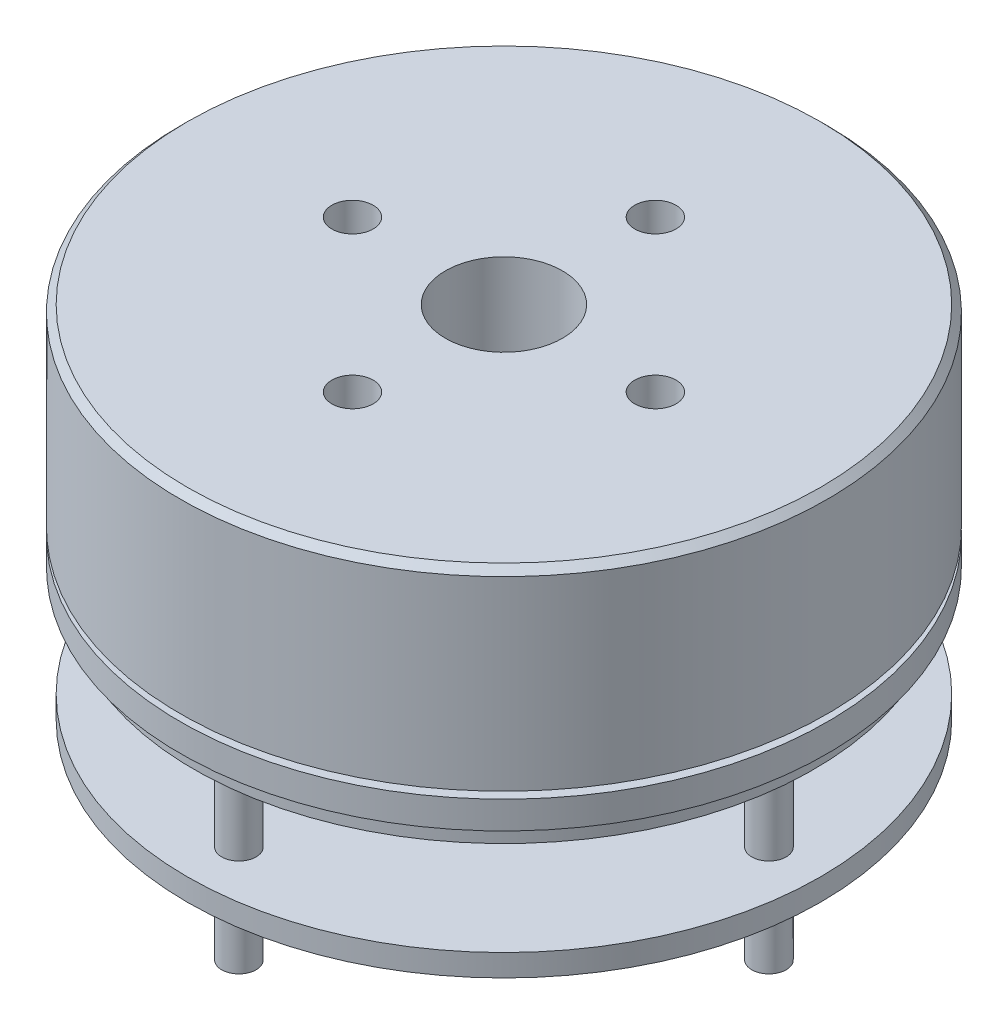
from build123d import *

# Parameters (mm, degrees)
SKETCH_2_R          = 1.5
CUT_EXTRUDE_1_DEPTH = 3
SKETCH_3_R          = 4.25
CUT_EXTRUDE_2_DEPTH = 18
SKETCH_6_R          = 1.25
EXTRUDE_1_DEPTH     = 6.5
SKETCH_7_R          = 23
EXTRUDE_2_DEPTH     = 1.6
SKETCH_10_R         = 1.25
EXTRUDE_3_DEPTH     = 5.5


with BuildPart() as part:
    # 草图1 → 旋转1 (revolve)
    with BuildSketch(Plane.XY, mode=Mode.PRIVATE) as revolve_1_sk:
        Polygon((23, 22.1), (0, 22.1), (0, 0), (4.75, 0), (7.5, 4.1), (22.5, 4.1), (22.5, 5.6), (23.5, 5.6), (23.5, 7.6), (22.5, 7.6), (22.5, 8.1), (23.5, 8.1), (23.5, 21.6), align=None)
    revolve(revolve_1_sk.sketch.rotate(Axis((0, 0, 0), (0, 1, 0)), 90), axis=Axis((0, 0, 0), (0, 1, 0)))

    # 草图2 → 切除-拉伸1 (cut)
    with BuildSketch(Plane(origin=(0, 22.1, 0), x_dir=(1, 0, 0), z_dir=(0, 1, 0))):
        with Locations(Location((0, 11, 0), (0, 0, 270))):
            Circle(SKETCH_2_R)
        with Locations(Location((11, 0, 0), (0, 0, 270))):
            Circle(SKETCH_2_R)
        with Locations(Location((0, -11, 0), (0, 0, 270))):
            Circle(SKETCH_2_R)
        with Locations(Location((-11, 0, 0), (0, 0, 270))):
            Circle(SKETCH_2_R)
    extrude(amount=-CUT_EXTRUDE_1_DEPTH, mode=Mode.SUBTRACT)

    # 草图3 → 切除-拉伸2 (cut)
    with BuildSketch(Plane(origin=(0, 22.1, 0), x_dir=(1, 0, 0), z_dir=(0, 1, 0))):
        with Locations(Location((0, 0, 0), (0, 0, 270))):
            Circle(SKETCH_3_R)
    extrude(amount=-CUT_EXTRUDE_2_DEPTH, mode=Mode.SUBTRACT)

    # 草图6 → 凸台-拉伸1 (add)
    with BuildSketch(Plane.XZ.offset(-4.1)):
        with Locations(Location((0, 19.25, 0), (0, 0, 90))):
            Circle(SKETCH_6_R)
        with Locations(Location((19.25, 0, 0), (0, 0, 90))):
            Circle(SKETCH_6_R)
        with Locations(Location((0, -19.25, 0), (0, 0, 90))):
            Circle(SKETCH_6_R)
        with Locations(Location((-19.25, 0, 0), (0, 0, 90))):
            Circle(SKETCH_6_R)
    extrude(amount=EXTRUDE_1_DEPTH)

    # 草图7 → 凸台-拉伸2 (add)
    with BuildSketch(Plane.XZ.offset(2.4)):
        with Locations(Location((0, 0, 0), (0, 0, 270))):
            Circle(SKETCH_7_R)
    extrude(amount=EXTRUDE_2_DEPTH)

    # 草图10 → 凸台-拉伸3 (add)
    with BuildSketch(Plane.XZ.offset(4)):
        with Locations(Location((0, 19.25, 0), (0, 0, 90))):
            Circle(SKETCH_10_R)
        with Locations(Location((19.25, 0, 0), (0, 0, 90))):
            Circle(SKETCH_10_R)
        with Locations(Location((0, -19.25, 0), (0, 0, 90))):
            Circle(SKETCH_10_R)
        with Locations(Location((-19.25, 0, 0), (0, 0, 90))):
            Circle(SKETCH_10_R)
    extrude(amount=EXTRUDE_3_DEPTH)


solid = part.part
